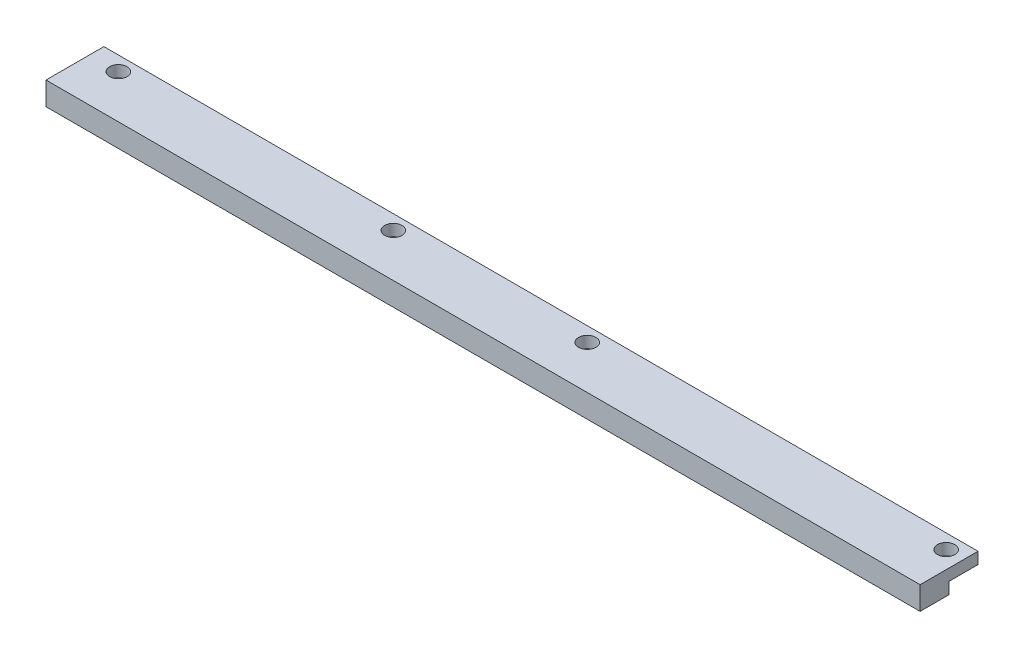
from build123d import *

# Parameters (mm, degrees)
SKETCH_1_W      = 151
SKETCH_1_H      = 5
SKETCH_1_R      = 1.5
EXTRUDE_1_DEPTH = 2
EXTRUDE_START   = 2
SKETCH_2_W      = 151
SKETCH_2_H      = 5
EXTRUDE_2_DEPTH = 4


with BuildPart() as part:
    # 草图1 → 凸台-拉伸1 (new body)
    with BuildSketch(Plane(origin=(0, 0, 0), x_dir=(1, 0, 0), z_dir=(0, 1, 0))):
        with Locations((75.5, -2.5)):
            Rectangle(SKETCH_1_W, SKETCH_1_H)
        with Locations(Location((5, -2.5, 0), (0, 0, 270))):
            Circle(SKETCH_1_R, mode=Mode.SUBTRACT)
        with Locations(Location((52.5, -2.5, 0), (0, 0, 270))):
            Circle(SKETCH_1_R, mode=Mode.SUBTRACT)
        with Locations(Location((86, -2.5, 0), (0, 0, 270))):
            Circle(SKETCH_1_R, mode=Mode.SUBTRACT)
        with Locations(Location((148, -2.5, 0), (0, 0, 270))):
            Circle(SKETCH_1_R, mode=Mode.SUBTRACT)
    extrude(amount=EXTRUDE_1_DEPTH)

    # 草图2 → 凸台-拉伸2 (add)
    with BuildSketch(Plane(origin=(0, 0, 0), x_dir=(1, 0, 0), z_dir=(0, 1, 0)).offset(EXTRUDE_START)):
        with Locations((75.5, -7.5)):
            Rectangle(SKETCH_2_W, SKETCH_2_H)
    extrude(amount=-EXTRUDE_2_DEPTH)


solid = part.part
